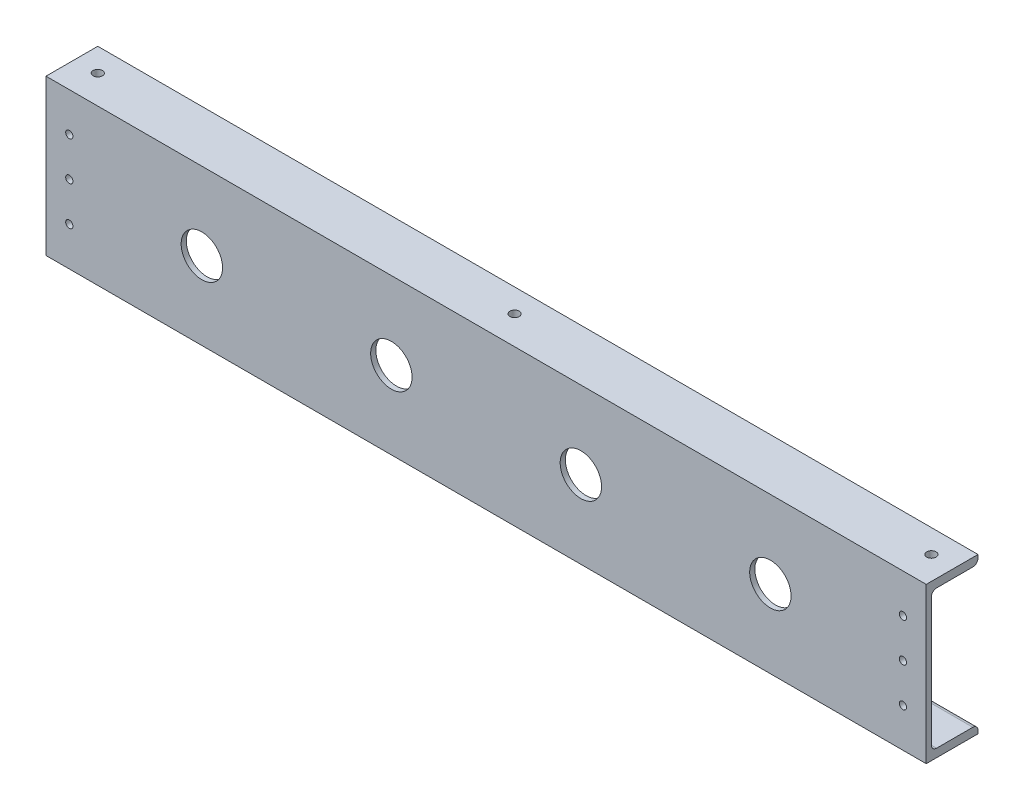
from build123d import *

# Parameters (mm, degrees)
BOSS_EXTRUDE1_DEPTH = 1700
SKETCH3_R           = 7
CUT_EXTRUDE1_DEPTH  = 10
SKETCH4_R           = 9
CUT_EXTRUDE2_DEPTH  = 20
LPATTERN1_COUNT     = 3
LPATTERN1_PITCH     = 805
SKETCH5_R           = 40
CUT_EXTRUDE3_DEPTH  = 30
LPATTERN2_COUNT     = 4
LPATTERN2_PITCH     = 366


with BuildPart() as part:
    # Sketch1 → Boss-Extrude1 (new body)
    with BuildSketch(Plane(origin=(0, 0, 0), x_dir=(0, 0, -1), z_dir=(1, 0, 0))):
        with BuildLine():
            Line((-86.622073579, 113.879598662), (-186.622073579, 113.879598662))
            Line((-186.622073579, 113.879598662), (-186.622073579, -186.120401338))
            Line((-186.622073579, -186.120401338), (-86.622073579, -186.120401338))
            Line((-86.622073579, -186.120401338), (-86.622073579, -180.120401338))
            ThreePointArc((-86.622073579, -180.120401338), (-89.551005767, -173.049333526), (-96.622073579, -170.120401338))
            Line((-96.622073579, -170.120401338), (-166.622073579, -170.120401338))
            ThreePointArc((-166.622073579, -170.120401338), (-173.69314139, -167.19146915), (-176.622073579, -160.120401338))
            Line((-176.622073579, -160.120401338), (-176.622073579, 87.879598662))
            ThreePointArc((-176.622073579, 87.879598662), (-173.69314139, 94.950666474), (-166.622073579, 97.879598662))
            Line((-166.622073579, 97.879598662), (-96.622073579, 97.879598662))
            ThreePointArc((-96.622073579, 97.879598662), (-89.551005767, 100.80853085), (-86.622073579, 107.879598662))
            Line((-86.622073579, 107.879598662), (-86.622073579, 113.879598662))
        make_face()
    extrude(amount=BOSS_EXTRUDE1_DEPTH)

    # Sketch3 → Cut-Extrude1 (cut)
    with BuildSketch(Plane.XY.offset(186.622073579)):
        with Locations((1655, 38.879598662)):
            Circle(SKETCH3_R)
        with Locations((1655, -36.120401338)):
            Circle(SKETCH3_R)
        with Locations((1655, -111.120401338)):
            Circle(SKETCH3_R)
    cut_extrude1 = extrude(amount=-CUT_EXTRUDE1_DEPTH, mode=Mode.SUBTRACT)

    # Mirror1: Cut-Extrude1 across plane
    add(cut_extrude1.mirror(Plane(origin=(850, 0, 0), x_dir=(0, 0, 1), z_dir=(1, 0, 0))), mode=Mode.SUBTRACT)

    # Sketch4 → Cut-Extrude2 (cut)
    with BuildSketch(Plane(origin=(0, 113.879598662, 0), x_dir=(1, 0, 0), z_dir=(0, 1, 0))):
        with Locations(Location((45, -131.622073579, 0), (0, 0, 270))):
            Circle(SKETCH4_R)
    cut_extrude2 = extrude(amount=-CUT_EXTRUDE2_DEPTH, mode=Mode.SUBTRACT)

    # LPattern1: Cut-Extrude2 ×3
    with Locations(*[(i * LPATTERN1_PITCH, 0, 0) for i in range(1, LPATTERN1_COUNT)]):
        add(cut_extrude2, mode=Mode.SUBTRACT)

    # Sketch5 → Cut-Extrude3 (cut)
    with BuildSketch(Plane(origin=(0, 0, 176.622073579), x_dir=(-1, 0, 0), z_dir=(0, 0, -1))):
        with Locations(Location((-1399, -36.120401338, 0), (0, 0, 90))):
            Circle(SKETCH5_R)
    cut_extrude3 = extrude(amount=-CUT_EXTRUDE3_DEPTH, mode=Mode.SUBTRACT)

    # LPattern2: Cut-Extrude3 ×4
    with Locations(*[(-i * LPATTERN2_PITCH, 0, 0) for i in range(1, LPATTERN2_COUNT)]):
        add(cut_extrude3, mode=Mode.SUBTRACT)


solid = part.part
